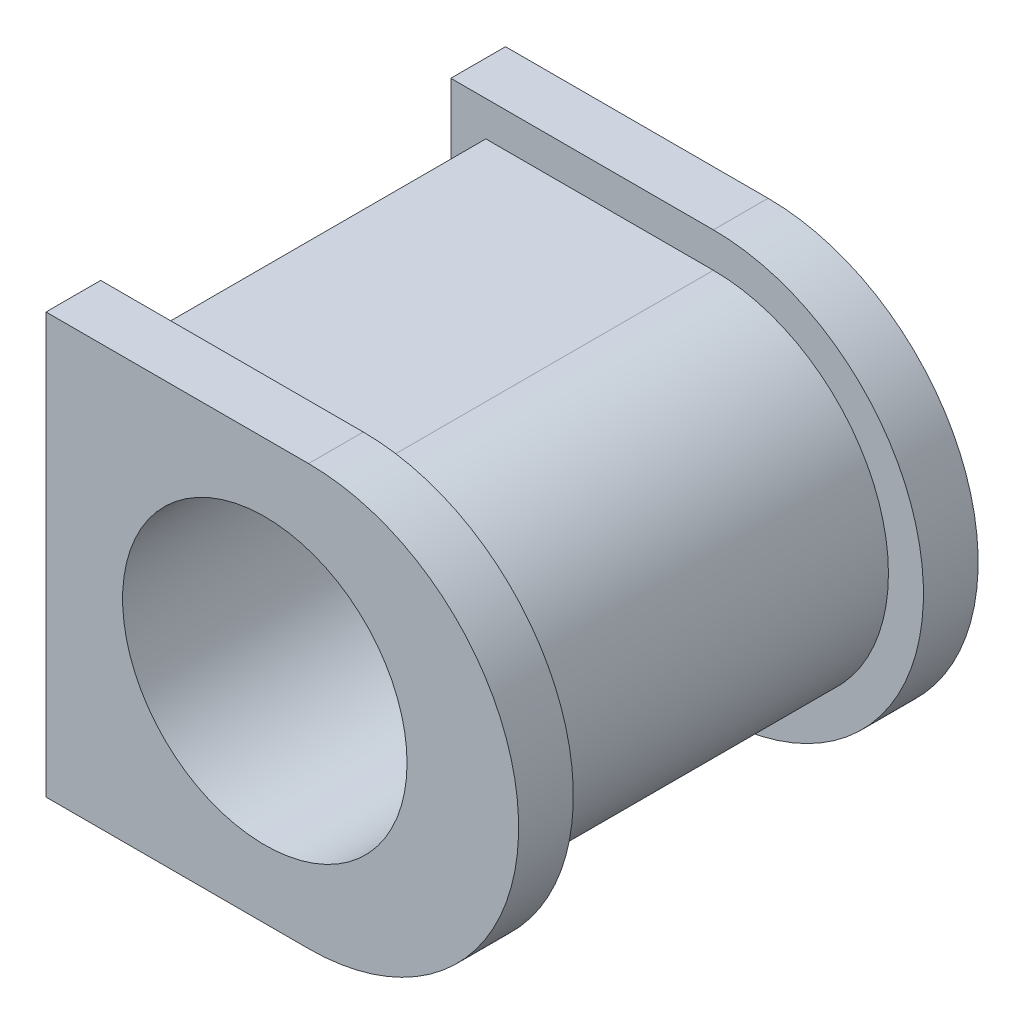
from build123d import *

# Parameters (mm, degrees)
SKETCH1_R           = 32.5
BOSS_EXTRUDE1_DEPTH = 40
SKETCH2_R           = 32.5
BOSS_EXTRUDE2_DEPTH = 12.5


with BuildPart() as part:
    # Sketch1 → Boss-Extrude1 (new, symmetric)
    with BuildSketch(Plane.XY):
        with BuildLine():
            Line((-26, -40), (26, -40))
            ThreePointArc((26, -40), (66, 0), (26, 40))
            Line((26, 40), (-26, 40))
            Line((-26, 40), (-26, -40))
        make_face()
        with Locations((16, 0)):
            Circle(SKETCH1_R, mode=Mode.SUBTRACT)
    extrude(amount=BOSS_EXTRUDE1_DEPTH, both=True)

    # Sketch2 → Boss-Extrude2 (add)
    with BuildSketch(Plane.XY.offset(40)):
        with BuildLine():
            Line((26, 48), (-34, 48))
            Line((-34, 48), (-34, -48))
            Line((-34, -48), (26, -48))
            ThreePointArc((26, -48), (74, 0), (26, 48))
        make_face()
        with Locations((16, 0)):
            Circle(SKETCH2_R, mode=Mode.SUBTRACT)
    boss_extrude2 = extrude(amount=BOSS_EXTRUDE2_DEPTH)

    # Mirror1: Boss-Extrude2 across plane
    add(boss_extrude2.mirror(Plane.XY))


solid = part.part
